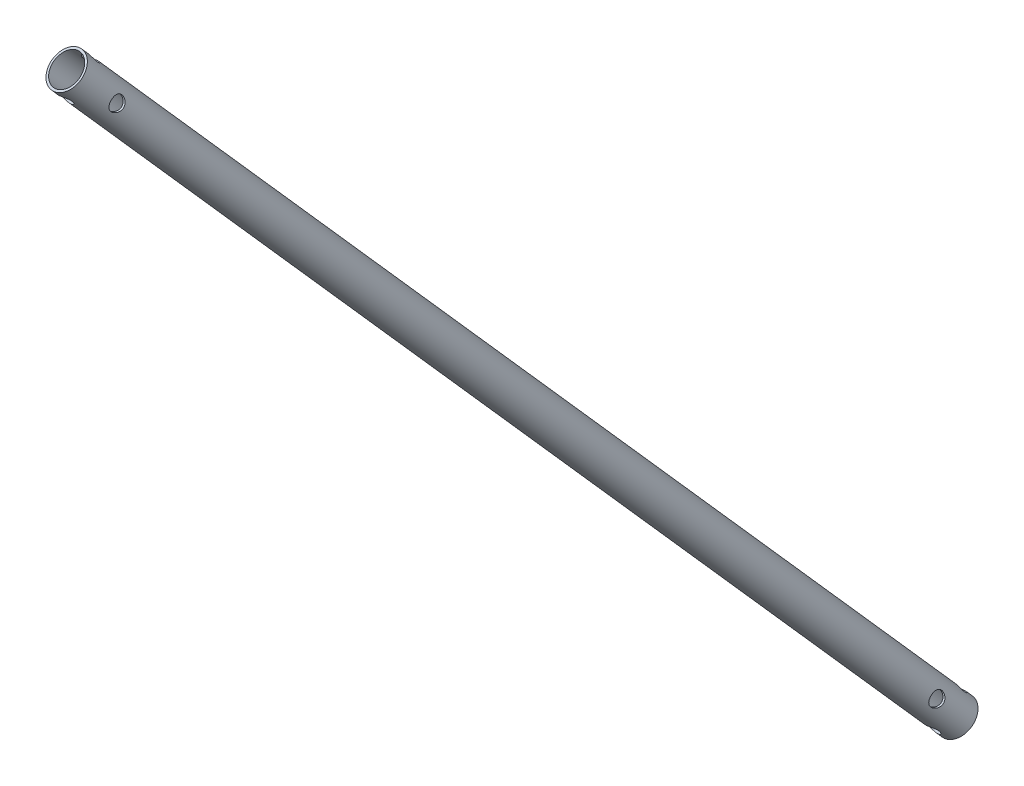
from build123d import *

# Parameters (mm, degrees)
SKETCH11_R              = 12.7
SKETCH11_R_2            = 11.1
PIPE_25_4_X_1_6_1_DEPTH = 754.625514282
SKETCH12_R              = 5
CUT_EXTRUDE1_DEPTH      = 20
SKETCH13_R              = 5
CUT_EXTRUDE2_DEPTH      = 20


with BuildPart() as part:
    # Sketch11 → Pipe 25.4 X 1.6(1) (new body)
    with BuildSketch(Plane(origin=(158.524995434, 944.598175378, -852.996061145), x_dir=(0.8987714984565639, 0.3944727236956189, -0.19131404502101412), z_dir=(0.19131404502101407, -0.7455229630983236, -0.6384312395793247))):
        Circle(SKETCH11_R)
        Circle(SKETCH11_R_2, mode=Mode.SUBTRACT)
    extrude(amount=PIPE_25_4_X_1_6_1_DEPTH)

    # Sketch12 → Cut-Extrude1 (cut, symmetric)
    with BuildSketch(Plane(origin=(0, 821.061078227, -958.787493431), x_dir=(0.1913140450210141, -0.7455229630983236, -0.6384312395793247), z_dir=(0, -0.6504457022184724, 0.7595527555512642))):
        with Locations(Location((615.313274424, 186.71304271, 0), (0, 0, 348.970519702))):
            Circle(SKETCH12_R)
        with Locations(Location((-119.312239858, 186.71304271, 0), (0, 0, 348.970519702))):
            Circle(SKETCH12_R)
    extrude(amount=CUT_EXTRUDE1_DEPTH, both=True, mode=Mode.SUBTRACT)

    # Sketch13 → Cut-Extrude2 (cut, symmetric)
    with BuildSketch(Plane(origin=(183.264243112, 27.131852927, 23.2344587), x_dir=(0.1913140450210141, -0.7455229630983236, -0.6384312395793247), z_dir=(-0.9815288768944588, -0.14531311007136988, -0.12443939835794995))):
        with Locations(Location((595.313274424, -1262.305332215, 0), (0, 0, 40.048251593))):
            Circle(SKETCH13_R)
        with Locations(Location((-99.312239858, -1262.305332215, 0), (0, 0, 40.048251593))):
            Circle(SKETCH13_R)
    extrude(amount=CUT_EXTRUDE2_DEPTH, both=True, mode=Mode.SUBTRACT)


solid = part.part
